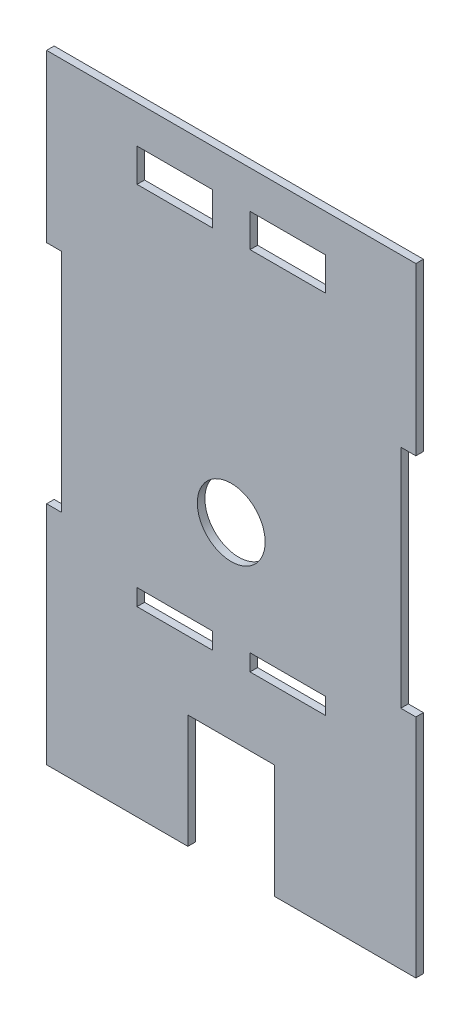
from build123d import *

# Parameters (mm, degrees)
MODEL_R         = 4.5
MODEL_W         = 10
MODEL_H         = 4.4
MODEL_H_2       = 2.2
EXTRUDE_1_DEPTH = 1


with BuildPart() as part:
    # Model → 凸台-拉伸1 (new body)
    with BuildSketch(Plane.XY):
        Polygon((4.031012873, 85.725728146), (53.031012873, 85.725728146), (53.031012873, 63.624082732), (51.031012873, 63.624082732), (51.031012873, 33.624082732), (53.031012873, 33.624082732), (53.031012873, 3.624082732), (34.281012873, 3.624082732), (34.281012873, 18.724082732), (28.531012873, 18.724082732), (22.781012873, 18.724082732), (22.781012873, 3.624082732), (4.031012873, 3.624082732), (4.031012873, 33.624082732), (6.031012873, 33.624082732), (6.031012873, 63.624082732), (4.031012873, 63.624082732), align=None)
        with Locations((28.531012873, 43.724082732)):
            Circle(MODEL_R, mode=Mode.SUBTRACT)
        with Locations((36.031012873, 78.525728146)):
            Rectangle(MODEL_W, MODEL_H, mode=Mode.SUBTRACT)
        with Locations((21.031012873, 78.525728146)):
            Rectangle(MODEL_W, MODEL_H, mode=Mode.SUBTRACT)
        with Locations((21.031012873, 28.897146128)):
            Rectangle(MODEL_W, MODEL_H_2, mode=Mode.SUBTRACT)
        with Locations((36.031012873, 28.897146128)):
            Rectangle(MODEL_W, MODEL_H_2, mode=Mode.SUBTRACT)
    extrude(amount=EXTRUDE_1_DEPTH)


solid = part.part
